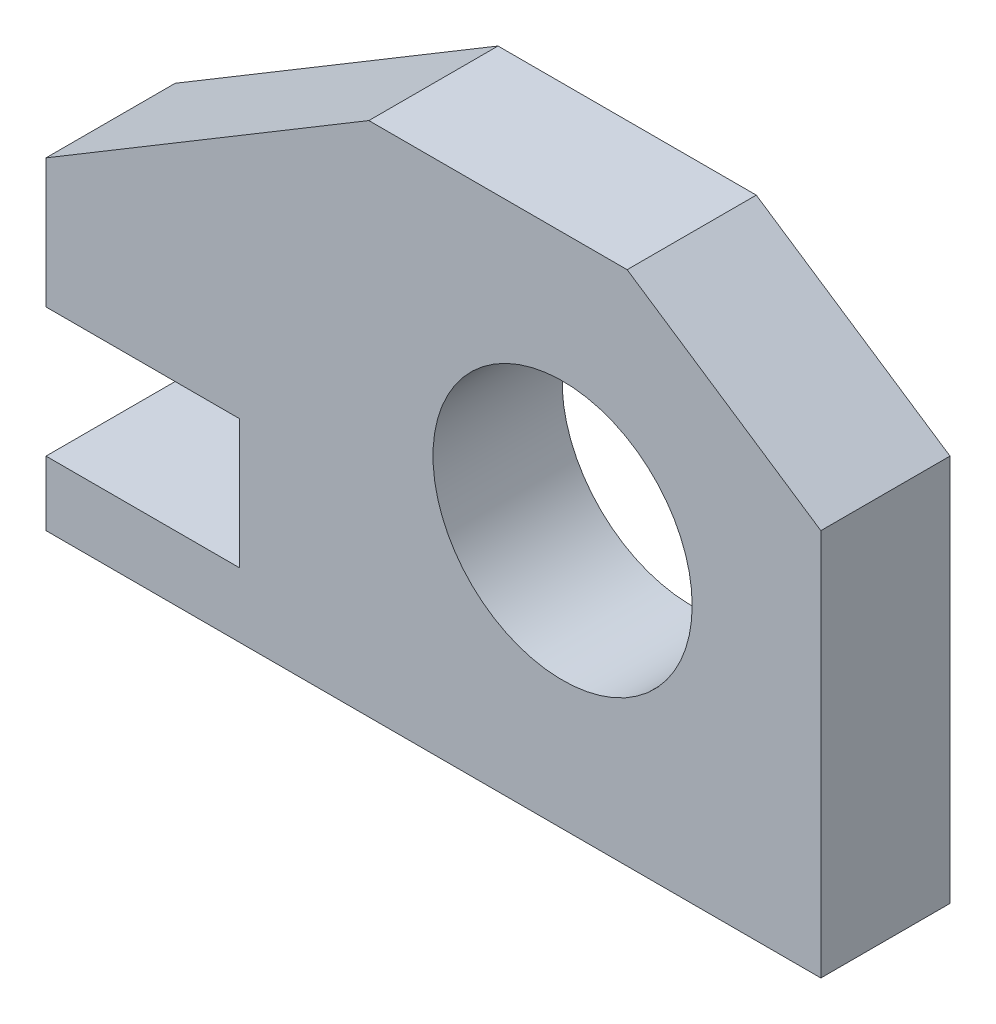
from build123d import *

# Parameters (mm, degrees)
BOSS_EXTRUDE1_DEPTH = 12.7
SKETCH2_R           = 12.745815336
CUT_EXTRUDE1_DEPTH  = 163.637115609


with BuildPart() as part:
    # Sketch1 → Boss-Extrude1 (new body)
    with BuildSketch(Plane.XY):
        Polygon((-117.910784314, 62.379411765), (-92.510784314, 62.379411765), (-73.460784314, 49.679411765), (-73.460784314, 11.579411765), (-149.660784314, 11.579411765), (-149.660784314, 17.929411765), (-130.610784314, 17.929411765), (-130.610784314, 30.629411765), (-149.660784314, 30.629411765), (-149.660784314, 43.329411765), align=None)
    extrude(amount=BOSS_EXTRUDE1_DEPTH)

    # Sketch2 → Cut-Extrude1 (cut, through all)
    with BuildSketch(Plane.XY.offset(12.7)):
        with Locations((-98.860784314, 36.979411765)):
            Circle(SKETCH2_R)
    extrude(amount=-CUT_EXTRUDE1_DEPTH, mode=Mode.SUBTRACT)


solid = part.part
